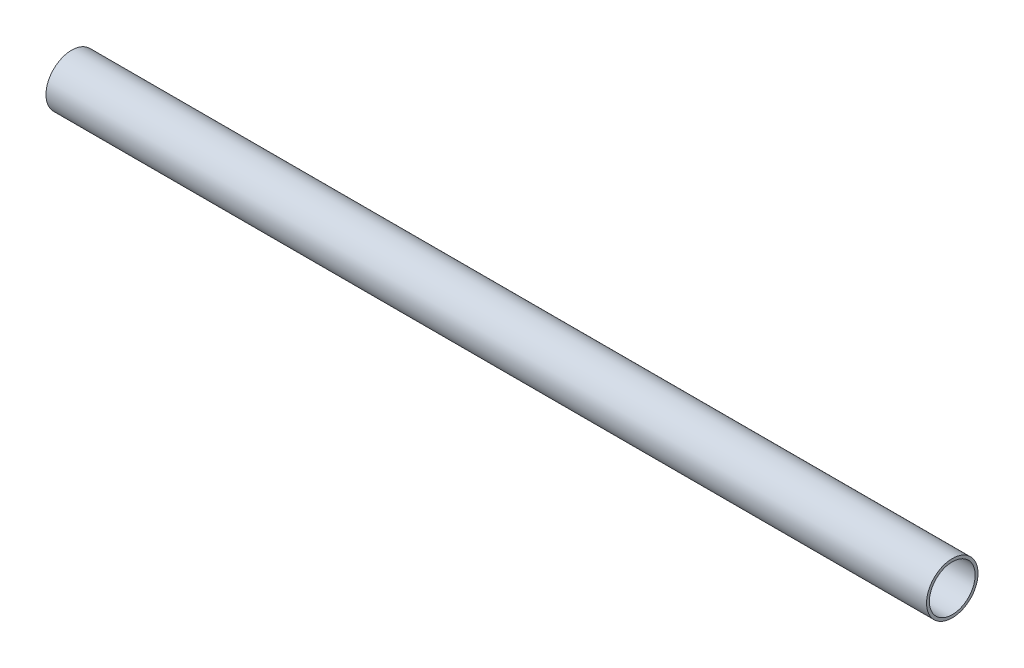
from build123d import *


with BuildPart() as part:
    # Sketch1 → Revolve1 (revolve)
    with BuildSketch(Plane.XY, mode=Mode.PRIVATE) as revolve1_sk:
        Polygon((0, 14.2875), (0, 0), (31.75, 0), (31.75, 12.7), (488.95, 12.7), (488.95, 14.2875), align=None)
    revolve(revolve1_sk.sketch.rotate(Axis((0, 0, 0), (1, 0, 0)), 270), axis=Axis((0, 0, 0), (1, 0, 0)))


solid = part.part
